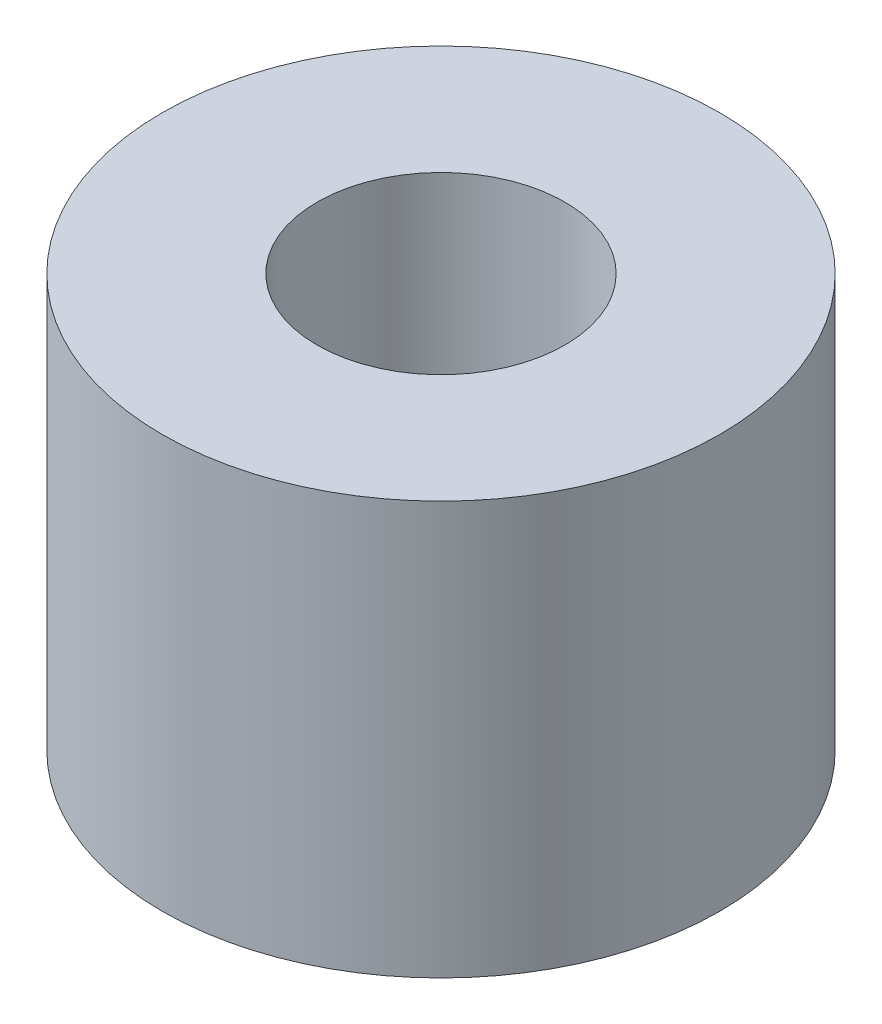
from build123d import *

# Parameters (mm, degrees)
SKETCH1_W = 2.9765625
SKETCH1_H = 7.9375


with BuildPart() as part:
    # Sketch1 → Revolve1 (revolve)
    with BuildSketch(Plane(origin=(0, 0, 0), x_dir=(0, 0, -1), z_dir=(1, 0, 0)), mode=Mode.PRIVATE) as revolve1_sk:
        with Locations((3.86953125, 0)):
            Rectangle(SKETCH1_W, SKETCH1_H)
    revolve(revolve1_sk.sketch.rotate(Axis((0, 10.01843826, 0), (0, -1, 0)), 180), axis=Axis((0, 10.01843826, 0), (0, -1, 0)))


solid = part.part
